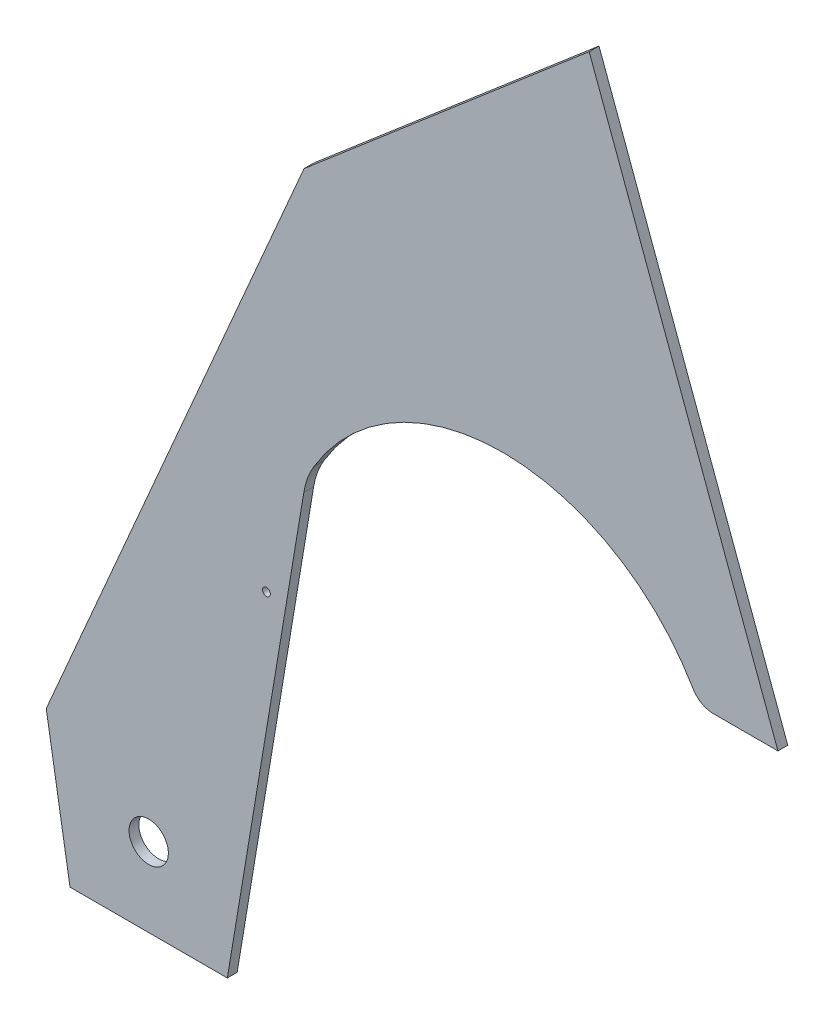
from build123d import *

# Parameters (mm, degrees)
SKETCH1_R           = 6.35
BOSS_EXTRUDE1_DEPTH = 3.175
CUT_EXTRUDE3_DEPTH  = 392.229140513
FILLET1_R           = 7.62
FILLET4_R           = 25.4
SKETCH5_R           = 1.27
CUT_EXTRUDE4_DEPTH  = 392.229140513


with BuildPart() as part:
    # Sketch1 → Boss-Extrude1 (new body)
    with BuildSketch(Plane.XY):
        with BuildLine():
            Line((0, 0), (50.8, 0))
            Line((50.8, 0), (76.2, 152.4))
            ThreePointArc((76.2, 152.4), (139.7, 191.491818659), (203.2, 152.4))
            Line((203.2, 152.4), (228.6, 152.4))
            Line((228.6, 152.4), (167.642212713, 317.477872869))
            Line((167.642212713, 317.477872869), (-25.4, 152.4))
            Line((-25.4, 152.4), (0, 0))
        make_face()
        with Locations((25.4, 25.4)):
            Circle(SKETCH1_R, mode=Mode.SUBTRACT)
    extrude(amount=BOSS_EXTRUDE1_DEPTH)

    # Sketch4 → Cut-Extrude3 (cut, through all)
    with BuildSketch(Plane.XY.offset(3.175)):
        Polygon((86.239354079, 263.432711485), (-16.185204596, 26.450399258), (-107.229256751, 193.810789249), align=None)
    extrude(amount=-CUT_EXTRUDE3_DEPTH, mode=Mode.SUBTRACT)

    # Fillet1
    fillet1_edges = [part.edges().sort_by_distance(p)[0] for p in [
        (203.2, 152.4, 1.5875),
    ]]
    fillet(fillet1_edges, radius=FILLET1_R)

    # Fillet4
    fillet4_edges = [part.edges().sort_by_distance(p)[0] for p in [
        (76.2, 152.4, 1.5875),
    ]]
    fillet(fillet4_edges, radius=FILLET4_R)

    # Sketch5 → Cut-Extrude4 (cut, through all)
    with BuildSketch(Plane(origin=(0, 0, 0), x_dir=(-1, 0, 0), z_dir=(0, 0, -1))):
        with Locations((-63.412409655, 114.3)):
            Circle(SKETCH5_R)
    extrude(amount=-CUT_EXTRUDE4_DEPTH, mode=Mode.SUBTRACT)


solid = part.part
